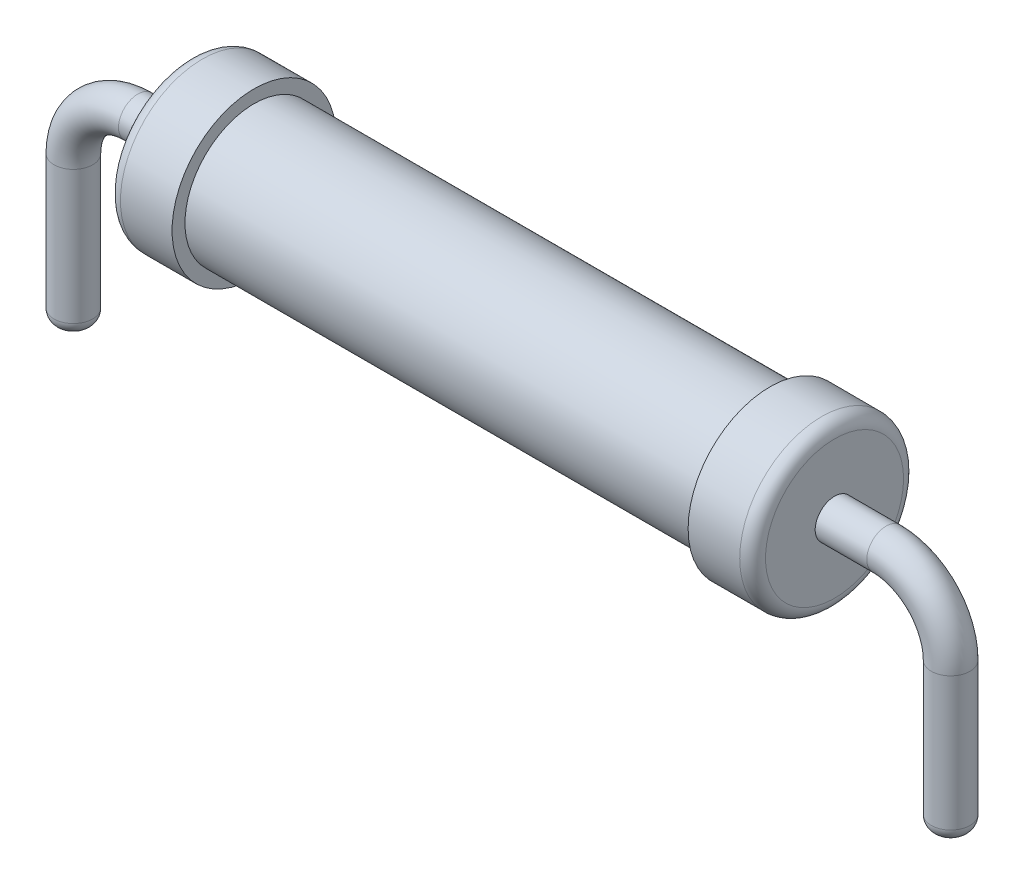
from build123d import *

# Parameters (mm, degrees)
SKETCH_1_R             = 1.27
EXTRUDE_1_DEPTH        = 5
FILLET_1_R             = 0.2
SKETCH_2_R             = 0.3
FILLET_2_R             = 0.2
FILLET_2_OF_MIRROR_1_R = 0.2
SKETCH_6_W             = 8
SKETCH_6_H             = 0.981075476


with BuildPart() as part:
    # 草图1 → 凸台-拉伸1 (new, symmetric)
    with BuildSketch(Plane(origin=(0, 0, 0), x_dir=(0, 0, -1), z_dir=(1, 0, 0))):
        Circle(SKETCH_1_R)
    extrude(amount=EXTRUDE_1_DEPTH, both=True)

    # 圆角1
    fillet_1_edges = [part.edges().sort_by_distance(p)[0] for p in [
        (-5, 0, 1.27),
        (5, 0, 1.27),
    ]]
    fillet(fillet_1_edges, radius=FILLET_1_R)

    # 扫描1: sweep along a path in 草图3
    with BuildLine(Plane.XY) as sweep_1_path:
        Line((5, 0), (5.8, 0))
        ThreePointArc((5.8, 0), (6.507106781, -0.292893219), (6.8, -1))
        Line((6.8, -1), (6.8, -3.27))
    # 草图2 → 扫描1 (sweep)
    with BuildSketch(Plane(origin=(5, 0, 0), x_dir=(0, 0, -1), z_dir=(1, 0, 0))):
        Circle(SKETCH_2_R)
    sweep_1 = sweep(path=sweep_1_path.line)

    # 圆角2
    fillet_2_edges = [part.edges().sort_by_distance(p)[0] for p in [
        (6.8, -3.27, 0.3),
    ]]
    fillet(fillet_2_edges, radius=FILLET_2_R)

    # 镜向1: 扫描1 across plane
    add(sweep_1.mirror(Plane(origin=(0, 0, 0), x_dir=(0, 0, 1), z_dir=(1, 0, 0))))

    # 圆角2 of 镜向1
    fillet_2_of_mirror_1_edges = [part.edges().sort_by_distance(p)[0] for p in [
        (-6.8, -3.27, 0.3),
    ]]
    fillet(fillet_2_of_mirror_1_edges, radius=FILLET_2_OF_MIRROR_1_R)

    # 草图6 → 切除-旋转2 (revolve, cut)
    with BuildSketch(Plane(origin=(0, 0, 0), x_dir=(1, 0, 0), z_dir=(0, 1, 0)), mode=Mode.PRIVATE) as cut_revolve_2_sk:
        with Locations((0, -1.560537738)):
            Rectangle(SKETCH_6_W, SKETCH_6_H)
    revolve(cut_revolve_2_sk.sketch.rotate(Axis((7.81, 0, 0), (-1, 0, 0)), 180), axis=Axis((7.81, 0, 0), (-1, 0, 0)), mode=Mode.SUBTRACT)


solid = part.part
